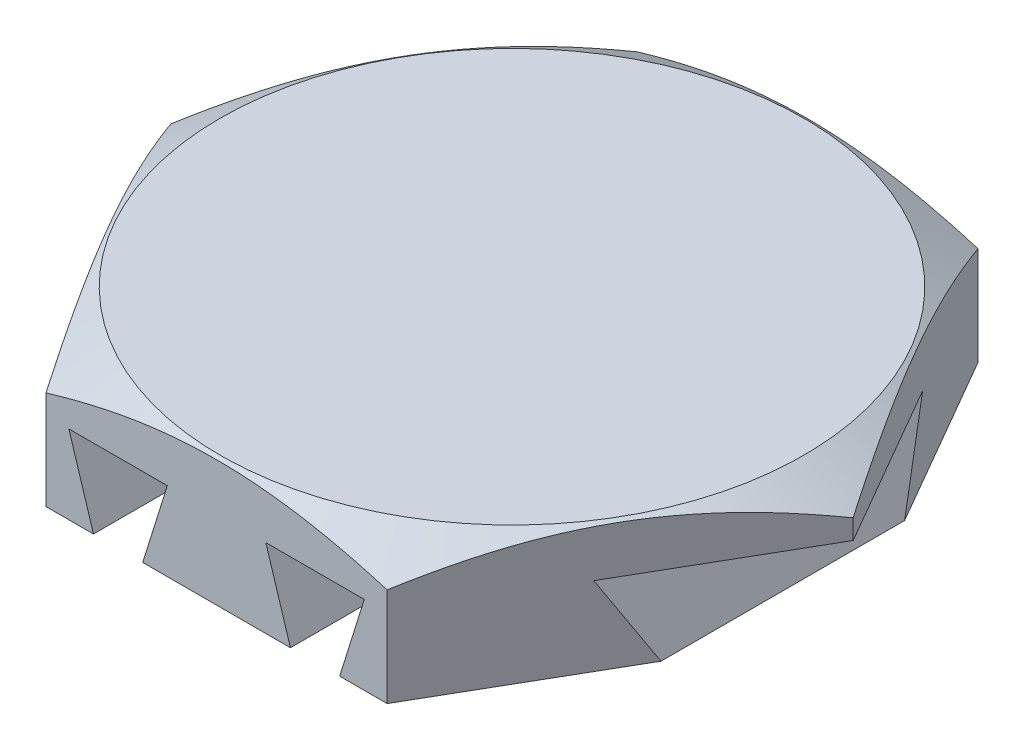
from build123d import *

# Parameters (mm, degrees)
EXTRUDE_1_DEPTH          = 13
CUT_EXTRUDE_1_DEPTH      = 48.634021455
CUT_EXTRUDE_1_DEPTH_BACK = 48.634021455


with BuildPart() as part:
    # 草圖1 → 填料-伸長1 (new body)
    with BuildSketch(Plane(origin=(0, 0, 0), x_dir=(1, 0, 0), z_dir=(0, 1, 0))):
        Polygon((17.320508076, -30), (34.641016151, 0), (17.320508076, 30), (-17.320508076, 30), (-34.641016151, 0), (-17.320508076, -30), align=None)
    extrude(amount=EXTRUDE_1_DEPTH)

    # 草圖2 → 除料-伸長1 (cut, two sides: drawn at the far end of the back side and taken through both)
    with BuildSketch(Plane.XY.offset(-CUT_EXTRUDE_1_DEPTH_BACK)):
        Polygon((-12.5, 0), (-7.5, 0), (-5, 8), (-15, 8), align=None)
        Polygon((-34.641016151, 0), (-27.5, 0), (-25, 8), (-34.641016151, 8), align=None)
        Polygon((5, 8), (7.5, 0), (12.5, 0), (15, 8), align=None)
        Polygon((25, 8), (27.5, 0), (34.641016151, 0), (34.641016151, 8), align=None)
    extrude(amount=CUT_EXTRUDE_1_DEPTH + CUT_EXTRUDE_1_DEPTH_BACK, mode=Mode.SUBTRACT)

    # 草圖3 → 除料-旋轉1 (revolve, cut)
    with BuildSketch(Plane.XY, mode=Mode.PRIVATE) as cut_revolve_1_sk:
        Polygon((0, 10), (-22.5, 10), (-20, 0), (0, 0), align=None)
    revolve(cut_revolve_1_sk.sketch.rotate(Axis((0, 13.801022721, 0), (0, -1, 0)), 270), axis=Axis((0, 13.801022721, 0), (0, -1, 0)), mode=Mode.SUBTRACT)

    # 草圖4 → 除料-旋轉7 (revolve, cut)
    with BuildSketch(Plane.XY, mode=Mode.PRIVATE) as cut_revolve_7_sk:
        Polygon((34.641016151, 10), (34.641016151, 13), (29.641016151, 13), align=None)
    revolve(cut_revolve_7_sk.sketch.rotate(Axis((0, 13, 0), (0, -1, 0)), 180), axis=Axis((0, 13, 0), (0, -1, 0)), mode=Mode.SUBTRACT)


solid = part.part
